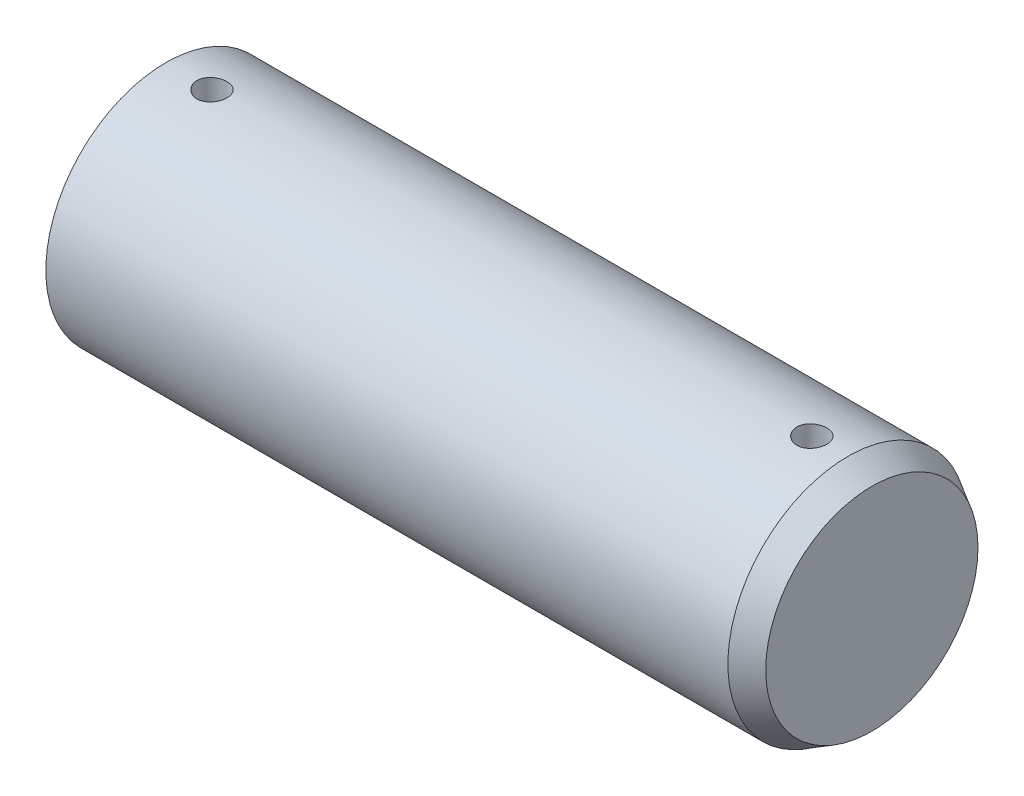
from build123d import *
from OCP.BRepFilletAPI import BRepFilletAPI_MakeChamfer

# Parameters (mm, degrees)
SKETCH2_R               = 12.7
BOSS_EXTRUDE1_DEPTH     = 76.2
CHAMFER1_SIZE           = 2.54
CHAMFER1_SIZE2          = 1.466469684
CUT_EXTRUDE1_DEPTH      = 79.288057838
CUT_EXTRUDE1_DEPTH_BACK = 79.288057838
SKETCH6_R               = 1.5875


with BuildPart() as part:
    # Sketch2 → Boss-Extrude1 (new body)
    with BuildSketch(Plane(origin=(0, 0, 0), x_dir=(0, 0, -1), z_dir=(1, 0, 0))):
        with Locations(Location((0, 0, 0), (0, 0, 180))):
            Circle(SKETCH2_R)
    extrude(amount=BOSS_EXTRUDE1_DEPTH)

    # Chamfer1: one chamfer whose edges measure the first distance from different faces: ONE call of the kernel's chamfer builder (chamfer() names one face for all edges)
    chamfer1_edges_1 = [part.edges().sort_by_distance(p)[0] for p in [
        (0, 0, -12.7),
    ]]
    chamfer1_side_1 = [part.faces().sort_by_distance(p)[0] for p in [
        (0, 0, 0),
    ]]
    chamfer1_edges_2 = [part.edges().sort_by_distance(p)[0] for p in [
        (76.2, 0, -12.7),
    ]]
    chamfer1_side_2 = [part.faces().sort_by_distance(p)[0] for p in [
        (38.1, 0, -12.7),
    ]]
    chamfer1 = BRepFilletAPI_MakeChamfer(part.part.solid().wrapped)
    for e in chamfer1_edges_1:
        chamfer1.Add(CHAMFER1_SIZE, CHAMFER1_SIZE2, e.wrapped, chamfer1_side_1[0].wrapped)  # the first distance lies on this face
    for e in chamfer1_edges_2:
        chamfer1.Add(CHAMFER1_SIZE, CHAMFER1_SIZE2, e.wrapped, chamfer1_side_2[0].wrapped)  # the first distance lies on this face
    add(Compound.cast(chamfer1.Shape()), mode=Mode.REPLACE)

    # Sketch6 → Cut-Extrude1 (cut, two sides: drawn at the far end of the back side and taken through both)
    with BuildSketch(Plane(origin=(0, 0, 0), x_dir=(1, 0, 0), z_dir=(0, 1, 0)).offset(-CUT_EXTRUDE1_DEPTH_BACK)):
        with Locations(Location((6.35, 0, 0), (0, 0, 270))):
            Circle(SKETCH6_R)
        with Locations(Location((69.85, 0, 0), (0, 0, 270))):
            Circle(SKETCH6_R)
    extrude(amount=CUT_EXTRUDE1_DEPTH + CUT_EXTRUDE1_DEPTH_BACK, mode=Mode.SUBTRACT)


solid = part.part
